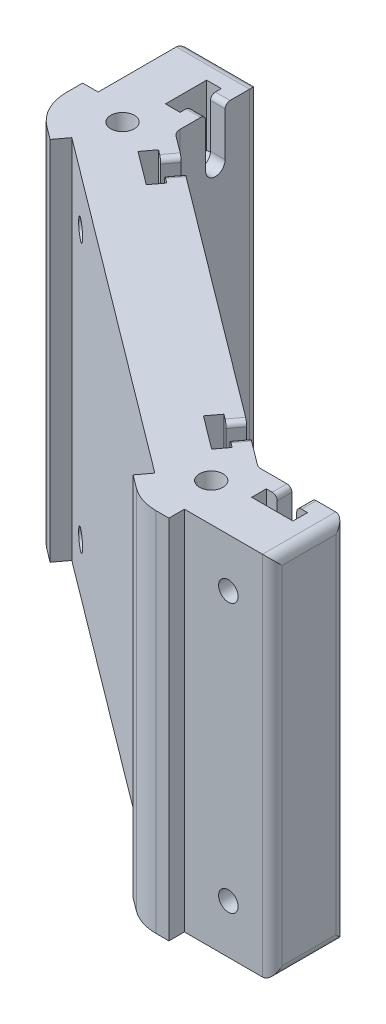
from build123d import *

# Parameters (mm, degrees)
BOSS_EXTRUDE1_DEPTH          = 75
SKETCH2_R                    = 2
CUT_EXTRUDE1_DEPTH           = 15
SKETCH3_R                    = 2
CUT_EXTRUDE2_DEPTH           = 15
SKETCH4_R                    = 2
CUT_EXTRUDE3_DEPTH           = 15
CUT_EXTRUDE5_START           = -3
CUT_EXTRUDE5_DEPTH           = 3
CUT_EXTRUDE6_START           = -3
CUT_EXTRUDE6_DEPTH           = 3
CUT_EXTRUDE7_START           = -3
CUT_EXTRUDE7_DEPTH           = 3
CUT_EXTRUDE8_START           = -3
CUT_EXTRUDE8_DEPTH           = 3
CUT_EXTRUDE9_START           = -3
CUT_EXTRUDE9_DEPTH           = 3
SKETCH5_R                    = 2.413
CUT_EXTRUDE4_DEPTH           = 6.35
CUT_EXTRUDE4_DRAFT           = -8
CUT_EXTRUDE4_PROFILE_2_DEPTH = 6.35
CUT_EXTRUDE4_PROFILE_2_DRAFT = -8
CUT_EXTRUDE10_START          = -3
CUT_EXTRUDE10_DEPTH          = 3
SKETCH14_R                   = 1.5205657
CUT_EXTRUDE12_DEPTH          = 5
MIRROR1_COPY_1_SKETCH_R      = 2.413
MIRROR1_COPY_1_DEPTH         = 6.35
MIRROR1_COPY_1_DRAFT         = -8
MIRROR1_COPY_2_SKETCH_R      = 2.413
MIRROR1_COPY_2_DEPTH         = 6.35
MIRROR1_COPY_2_DRAFT         = -8
MIRROR1_COPY_3_SKETCH_R      = 2.413
MIRROR1_COPY_3_DEPTH         = 6.35
MIRROR1_COPY_3_DRAFT         = -8
FILLET1_R                    = 1
FILLET2_R                    = 2


with BuildPart() as part:
    # Sketch1 → Boss-Extrude1 (new body)
    with BuildSketch(Plane(origin=(0, 0, 0), x_dir=(1, 0, 0), z_dir=(0, 1, 0))):
        with BuildLine():
            Line((-11.628333333, 18.94), (2.725, 8.175))
            Line((2.725, 8.175), (20.666666667, 8.175))
            Line((20.666666667, 8.175), (20.666666667, -6.825))
            Line((20.666666667, -6.825), (2.666666667, -6.825))
            Line((2.666666667, -6.825), (2.666666667, -10))
            Line((2.666666667, -10), (0, -10))
            ThreePointArc((0, -10), (-3.16227766, -9.486832981), (-6, -8))
            Line((-6, -8), (-8.666666667, -6))
            Line((-8.666666667, -6), (-6.761666667, -3.46))
            Line((-6.761666667, -3.46), (-74.761666667, 47.54))
            Line((-74.761666667, 47.54), (-76.666666667, 45))
            Line((-76.666666667, 45), (-79.333333333, 47))
            ThreePointArc((-79.333333333, 47), (-82.277605243, 50.527864045), (-83.333333333, 55))
            Line((-83.333333333, 55), (-83.333333333, 58.333333333))
            Line((-83.333333333, 58.333333333), (-80.158333333, 58.333333333))
            Line((-80.158333333, 58.333333333), (-80.158333333, 76.333333333))
            Line((-80.158333333, 76.333333333), (-65.158333333, 76.333333333))
            Line((-65.158333333, 76.333333333), (-65.158333333, 59.0875))
            Line((-65.158333333, 59.0875), (-51.361666667, 48.74))
            Line((-51.361666667, 48.74), (-11.628333333, 18.94))
        make_face()
    extrude(amount=BOSS_EXTRUDE1_DEPTH)

    # Sketch2 → Cut-Extrude1 (cut)
    with BuildSketch(Plane.XY.offset(6.825)):
        with Locations((11.666666667, 10)):
            Circle(SKETCH2_R)
        with Locations((11.666666667, 65)):
            Circle(SKETCH2_R)
    extrude(amount=-CUT_EXTRUDE1_DEPTH, mode=Mode.SUBTRACT)

    # Sketch3 → Cut-Extrude2 (cut)
    with BuildSketch(Plane(origin=(-4.095, 0, 5.46), x_dir=(0.8000000000000002, 0, 0.5999999999999999), z_dir=(-0.5999999999999999, 0, 0.8000000000000003))):
        with Locations((-12.333333333, 10)):
            Circle(SKETCH3_R)
        with Locations((-12.333333333, 65)):
            Circle(SKETCH3_R)
        with Locations((-79.333333333, 10)):
            Circle(SKETCH3_R)
        with Locations((-79.333333333, 65)):
            Circle(SKETCH3_R)
    extrude(amount=-CUT_EXTRUDE2_DEPTH, mode=Mode.SUBTRACT)

    # Sketch4 → Cut-Extrude3 (cut)
    with BuildSketch(Plane.ZY.offset(80.158333333)):
        with Locations((-67.333333333, 10)):
            Circle(SKETCH4_R)
        with Locations((-67.333333333, 65)):
            Circle(SKETCH4_R)
    extrude(amount=-CUT_EXTRUDE3_DEPTH, mode=Mode.SUBTRACT)

    # Sketch6 → Cut-Extrude5 (cut)
    with BuildSketch(Plane(origin=(4.905, 0, -6.54), x_dir=(-0.8000000000000002, 0, -0.6), z_dir=(0.6, 0, -0.8000000000000002)).offset(CUT_EXTRUDE5_START)):
        Polygon((8.114583333, 62.564303552), (12.333333333, 60.128607104), (16.552083333, 62.564303552), (16.552083333, 75), (8.114583333, 75), align=None)
        Polygon((75.114583333, 62.564303552), (79.333333333, 60.128607104), (83.552083333, 62.564303552), (83.552083333, 75), (75.114583333, 75), align=None)
        Polygon((8.114583333, 12.435696448), (12.333333333, 14.871392896), (16.552083333, 12.435696448), (16.552083333, 0), (8.114583333, 0), align=None)
        Polygon((75.114583333, 12.435696448), (79.333333333, 14.871392896), (83.552083333, 12.435696448), (83.552083333, 0), (75.114583333, 0), align=None)
    extrude(amount=-CUT_EXTRUDE5_DEPTH, mode=Mode.SUBTRACT)

    # Sketch7 → Cut-Extrude6 (cut)
    with BuildSketch(Plane(origin=(4.905, 0, -6.54), x_dir=(-0.8000000000000002, 0, -0.6), z_dir=(0.6, 0, -0.8000000000000002)).offset(CUT_EXTRUDE6_START)):
        with BuildLine():
            Line((14.333333333, 65), (14.333333333, 75))
            Line((14.333333333, 75), (10.333333333, 75))
            Line((10.333333333, 75), (10.333333333, 65))
            ThreePointArc((10.333333333, 65), (12.333333333, 67), (14.333333333, 65))
        make_face()
        with BuildLine():
            Line((81.333333333, 65), (81.333333333, 75))
            Line((81.333333333, 75), (77.333333333, 75))
            Line((77.333333333, 75), (77.333333333, 65))
            ThreePointArc((77.333333333, 65), (79.333333333, 67), (81.333333333, 65))
        make_face()
        with BuildLine():
            Line((81.333333333, 0), (77.333333333, 0))
            Line((77.333333333, 0), (77.333333333, 10))
            ThreePointArc((77.333333333, 10), (79.333333333, 8), (81.333333333, 10))
            Line((81.333333333, 10), (81.333333333, 0))
        make_face()
        with BuildLine():
            Line((14.333333333, 0), (10.333333333, 0))
            Line((10.333333333, 0), (10.333333333, 10))
            ThreePointArc((10.333333333, 10), (12.333333333, 8), (14.333333333, 10))
            Line((14.333333333, 10), (14.333333333, 0))
        make_face()
    extrude(amount=CUT_EXTRUDE6_DEPTH, mode=Mode.SUBTRACT)

    # Sketch8 → Cut-Extrude7 (cut)
    with BuildSketch(Plane(origin=(0, 0, -8.175), x_dir=(-1, 0, 0), z_dir=(0, 0, -1)).offset(CUT_EXTRUDE7_START)):
        Polygon((-15.885416667, 0), (-15.885416667, 12.435696448), (-11.666666667, 14.871392896), (-7.447916667, 12.435696448), (-7.447916667, 0), align=None)
        Polygon((-15.885416667, 62.564303552), (-11.666666667, 60.128607104), (-7.447916667, 62.564303552), (-7.447916667, 75), (-15.885416667, 75), align=None)
    extrude(amount=-CUT_EXTRUDE7_DEPTH, mode=Mode.SUBTRACT)

    # Sketch9 → Cut-Extrude8 (cut)
    with BuildSketch(Plane(origin=(0, 0, -8.175), x_dir=(-1, 0, 0), z_dir=(0, 0, -1)).offset(CUT_EXTRUDE8_START)):
        with BuildLine():
            Line((-9.666666667, 65), (-9.666666667, 75))
            Line((-9.666666667, 75), (-13.666666667, 75))
            Line((-13.666666667, 75), (-13.666666667, 65))
            ThreePointArc((-13.666666667, 65), (-11.666666667, 67), (-9.666666667, 65))
        make_face()
        with BuildLine():
            Line((-13.666666667, 10), (-13.666666667, 0))
            Line((-13.666666667, 0), (-9.666666667, 0))
            Line((-9.666666667, 0), (-9.666666667, 10))
            ThreePointArc((-9.666666667, 10), (-11.666666667, 8), (-13.666666667, 10))
        make_face()
    extrude(amount=CUT_EXTRUDE8_DEPTH, mode=Mode.SUBTRACT)

    # Sketch10 → Cut-Extrude9 (cut)
    with BuildSketch(Plane(origin=(-65.158333333, 0, 0), x_dir=(0, 0, -1), z_dir=(1, 0, 0)).offset(CUT_EXTRUDE9_START)):
        Polygon((63.114583333, 62.564303552), (67.333333333, 60.128607104), (71.552083333, 62.564303552), (71.552083333, 75), (63.114583333, 75), align=None)
        Polygon((63.114583333, 12.435696448), (67.333333333, 14.871392896), (71.552083333, 12.435696448), (71.552083333, 0), (63.114583333, 0), align=None)
    extrude(amount=-CUT_EXTRUDE9_DEPTH, mode=Mode.SUBTRACT)


with BuildPart() as cut_extrude4_tool:
    # Sketch5 → Cut-Extrude4 (with draft: the straight prism first)
    with BuildSketch(Plane(origin=(0, 75, 0), x_dir=(1, 0, 0), z_dir=(0, 1, 0))):
        with Locations((0.333333333, 1)):
            Circle(SKETCH5_R)
    extrude(amount=-CUT_EXTRUDE4_DEPTH)
    # Cut-Extrude4: the draft: its side faces are tilted about the plane it starts from
    cut_extrude4_sides = [cut_extrude4_tool.faces().sort_by_distance(p)[0] for p in [
        (-2.079666667, 71.825, -1),
    ]]
    draft(cut_extrude4_sides, Plane(origin=(0, 75, 0), x_dir=(1, 0, 0), z_dir=(0, 1, 0)), CUT_EXTRUDE4_DRAFT)


with BuildPart() as part_1:
    add(part.part)

    # Cut-Extrude4: cut by cut_extrude4_tool
    add(cut_extrude4_tool.part, mode=Mode.SUBTRACT)


with BuildPart() as cut_extrude4_profile_2_tool:
    # Sketch5 → Cut-Extrude4 profile 2 (with draft: the straight prism first)
    with BuildSketch(Plane(origin=(0, 75, 0), x_dir=(1, 0, 0), z_dir=(0, 1, 0))):
        with Locations((-72.333333333, 55.5)):
            Circle(SKETCH5_R)
    extrude(amount=-CUT_EXTRUDE4_PROFILE_2_DEPTH)
    # Cut-Extrude4 profile 2: the draft: its side faces are tilted about the plane it starts from
    cut_extrude4_profile_2_sides = [cut_extrude4_profile_2_tool.faces().sort_by_distance(p)[0] for p in [
        (-74.746333333, 71.825, -55.5),
    ]]
    draft(cut_extrude4_profile_2_sides, Plane(origin=(0, 75, 0), x_dir=(1, 0, 0), z_dir=(0, 1, 0)), CUT_EXTRUDE4_PROFILE_2_DRAFT)


with BuildPart() as part_2:
    add(part_1.part)

    # Cut-Extrude4 profile 2: cut by cut_extrude4_profile_2_tool
    add(cut_extrude4_profile_2_tool.part, mode=Mode.SUBTRACT)

    # Sketch11 → Cut-Extrude10 (cut)
    with BuildSketch(Plane(origin=(-65.158333333, 0, 0), x_dir=(0, 0, -1), z_dir=(1, 0, 0)).offset(CUT_EXTRUDE10_START)):
        with BuildLine():
            Line((69.333333333, 65), (69.333333333, 75))
            Line((69.333333333, 75), (65.333333333, 75))
            Line((65.333333333, 75), (65.333333333, 65))
            ThreePointArc((65.333333333, 65), (67.333333333, 67), (69.333333333, 65))
        make_face()
        with BuildLine():
            Line((69.333333333, 10), (69.333333333, 0))
            Line((69.333333333, 0), (65.333333333, 0))
            Line((65.333333333, 0), (65.333333333, 10))
            ThreePointArc((65.333333333, 10), (67.333333333, 8), (69.333333333, 10))
        make_face()
    extrude(amount=CUT_EXTRUDE10_DEPTH, mode=Mode.SUBTRACT)

    # Sketch14 → Cut-Extrude12 (cut)
    with BuildSketch(Plane(origin=(0, 68.65, 0), x_dir=(1, 0, 0), z_dir=(0, 1, 0))):
        with Locations(Location((-72.333333333, 55.5, 0), (0, 0, 270))):
            Circle(SKETCH14_R)
        with Locations(Location((0.333333333, 1, 0), (0, 0, 270))):
            Circle(SKETCH14_R)
    cut_extrude12 = extrude(amount=-CUT_EXTRUDE12_DEPTH, mode=Mode.SUBTRACT)

    # Mirror1: Cut-Extrude12 across plane
    add(cut_extrude12.mirror(Plane.ZX.offset(37.5)), mode=Mode.SUBTRACT)


with BuildPart() as mirror1_copy_1_tool:
    # Mirror1 copy 1 sketch → Mirror1 copy 1 (with draft: the straight prism first)
    with BuildSketch(Plane.XZ):
        with Locations((0.333333333, -1)):
            Circle(MIRROR1_COPY_1_SKETCH_R)
    extrude(amount=-MIRROR1_COPY_1_DEPTH)
    # Mirror1 copy 1: the draft: its side faces are tilted about the plane it starts from
    mirror1_copy_1_sides = [mirror1_copy_1_tool.faces().sort_by_distance(p)[0] for p in [
        (-2.079666667, 3.175, -1),
    ]]
    draft(mirror1_copy_1_sides, Plane.XZ, MIRROR1_COPY_1_DRAFT)


with BuildPart() as part_3:
    add(part_2.part)

    # Mirror1 copy 1: cut by mirror1_copy_1_tool
    add(mirror1_copy_1_tool.part, mode=Mode.SUBTRACT)


with BuildPart() as mirror1_copy_2_tool:
    # Mirror1 copy 2 sketch → Mirror1 copy 2 (with draft: the straight prism first)
    with BuildSketch(Plane.XZ):
        with Locations((-72.333333333, -55.5)):
            Circle(MIRROR1_COPY_2_SKETCH_R)
    extrude(amount=-MIRROR1_COPY_2_DEPTH)
    # Mirror1 copy 2: the draft: its side faces are tilted about the plane it starts from
    mirror1_copy_2_sides = [mirror1_copy_2_tool.faces().sort_by_distance(p)[0] for p in [
        (-74.746333333, 3.175, -55.5),
    ]]
    draft(mirror1_copy_2_sides, Plane.XZ, MIRROR1_COPY_2_DRAFT)


with BuildPart() as part_4:
    add(part_3.part)

    # Mirror1 copy 2: cut by mirror1_copy_2_tool
    add(mirror1_copy_2_tool.part, mode=Mode.SUBTRACT)


with BuildPart() as mirror1_copy_3_tool:
    # Mirror1 copy 3 sketch → Mirror1 copy 3 (with draft: the straight prism first)
    with BuildSketch(Plane.XZ):
        with Locations((-72.333333333, -55.5)):
            Circle(MIRROR1_COPY_3_SKETCH_R)
    extrude(amount=-MIRROR1_COPY_3_DEPTH)
    # Mirror1 copy 3: the draft: its side faces are tilted about the plane it starts from
    mirror1_copy_3_sides = [mirror1_copy_3_tool.faces().sort_by_distance(p)[0] for p in [
        (-74.746333333, 3.175, -55.5),
    ]]
    draft(mirror1_copy_3_sides, Plane.XZ, MIRROR1_COPY_3_DRAFT)


with BuildPart() as part_5:
    add(part_4.part)

    # Mirror1 copy 3: cut by mirror1_copy_3_tool
    add(mirror1_copy_3_tool.part, mode=Mode.SUBTRACT)

    # Fillet1
    fillet1_edges = [part_5.edges().sort_by_distance(p)[0] for p in [
        (-7.461666667, 0, -13.94),
        (-4.261666667, 0, -11.54),
        (-61.061666667, 0, -54.14),
        (-57.861666667, 0, -51.74),
        (-57.861666667, 75, -51.74),
        (-61.061666667, 75, -54.14),
        (-4.261666667, 75, -11.54),
        (-7.461666667, 75, -13.94),
        (13.666666667, 75, -6.675),
        (9.666666667, 75, -6.675),
        (9.666666667, 0, -6.675),
        (13.666666667, 0, -6.675),
        (-66.658333333, 75, -65.333333333),
        (-66.658333333, 75, -69.333333333),
        (-66.658333333, 0, -69.333333333),
        (-66.658333333, 0, -65.333333333),
    ]]
    fillet(fillet1_edges, radius=FILLET1_R)

    # Fillet2
    fillet2_edges = [part_5.edges().sort_by_distance(p)[0] for p in [
        (20.666666667, 75, -0.675),
        (-72.658333333, 0, -76.333333333),
        (20.666666667, 0, -0.675),
        (-80.158333333, 37.5, -76.333333333),
        (-65.158333333, 37.5, -76.333333333),
        (-65.158333333, 37.5, -59.0875),
        (2.725, 37.5, -8.175),
        (20.666666667, 37.5, -8.175),
        (20.666666667, 37.5, 6.825),
        (-72.658333333, 75, -76.333333333),
    ]]
    fillet(fillet2_edges, radius=FILLET2_R)


solid = part_5.part
